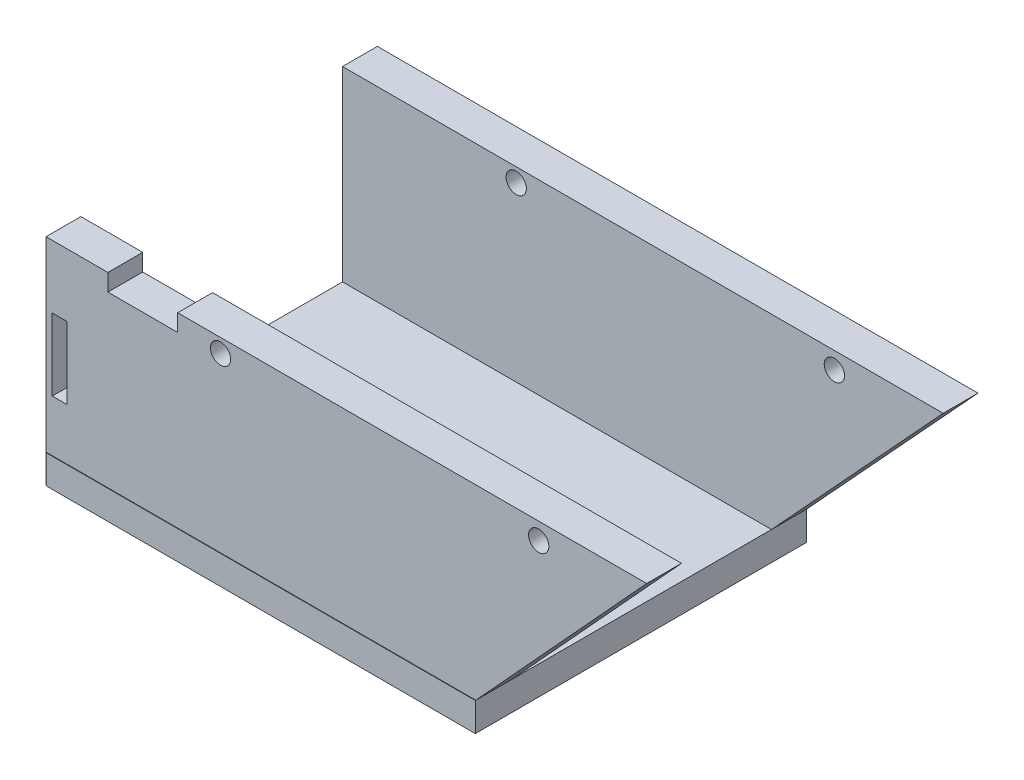
from build123d import *

# Parameters (mm, degrees)
SKETCH1_W           = 83.722982013
SKETCH1_H           = 46.138643349
BOSS_EXTRUDE1_DEPTH = 4
SKETCH2_W           = 83.722982013
SKETCH2_H           = 4.859440563
BOSS_EXTRUDE2_DEPTH = 30
CUT_EXTRUDE10_DEPTH = 18
CUT_EXTRUDE11_DEPTH = 18
SKETCH7_W           = 22.745855452
SKETCH7_H           = 4
CUT_EXTRUDE14_DEPTH = 54
SKETCH8_W           = 11.05148618
SKETCH8_H           = 10.398194851
CUT_EXTRUDE15_DEPTH = 2
SKETCH9_W           = 9.731504247
SKETCH9_H           = 2.37712486
CUT_EXTRUDE16_DEPTH = 8
SKETCH10_W          = 2.06895071
SKETCH10_H          = 10.033558555
CUT_EXTRUDE17_DEPTH = 8
SKETCH11_W          = 1.186464173
SKETCH11_H          = 4
CUT_EXTRUDE18_DEPTH = 47
CUT_EXTRUDE19_DEPTH = 47
SKETCH13_R          = 1.414529115
CUT_EXTRUDE20_DEPTH = 58


with BuildPart() as part:
    # Sketch1 → Boss-Extrude1 (new body)
    with BuildSketch(Plane(origin=(0, 0, 0), x_dir=(1, 0, 0), z_dir=(0, 1, 0))):
        with Locations((41.861491007, 23.069321675)):
            Rectangle(SKETCH1_W, SKETCH1_H)
    extrude(amount=BOSS_EXTRUDE1_DEPTH)

    # Sketch2 → Boss-Extrude2 (add)
    with BuildSketch(Plane(origin=(0, 0, 0), x_dir=(1, 0, 0), z_dir=(0, 1, 0))):
        with Locations((41.861491007, 43.708923068)):
            Rectangle(SKETCH2_W, SKETCH2_H)
        with Locations((41.740293795, 2.496094928)):
            Rectangle(SKETCH2_W, SKETCH2_H)
    extrude(amount=BOSS_EXTRUDE2_DEPTH)

    # Sketch3 → Cut-Extrude10 (cut)
    with BuildSketch(Plane.XY.offset(-0.066374646)):
        Polygon((83.601784801, 30), (83.601784801, 4), (60.885327478, 4), align=None)
    extrude(amount=-CUT_EXTRUDE10_DEPTH, mode=Mode.SUBTRACT)

    # Sketch6 → Cut-Extrude11 (cut)
    with BuildSketch(Plane.XY.offset(-41.279202786)):
        Polygon((83.722982013, 30), (59.790662388, 4), (83.722982013, 4), align=None)
    extrude(amount=-CUT_EXTRUDE11_DEPTH, mode=Mode.SUBTRACT)

    # Sketch7 → Cut-Extrude14 (cut)
    with BuildSketch(Plane.XY):
        with Locations((72.350054287, 2)):
            Rectangle(SKETCH7_W, SKETCH7_H)
    extrude(amount=-CUT_EXTRUDE14_DEPTH, mode=Mode.SUBTRACT)

    # Sketch8 → Cut-Extrude15 (cut)
    with BuildSketch(Plane.XZ):
        with Locations((23.113449186, -14.294853075)):
            Rectangle(SKETCH8_W, SKETCH8_H)
    extrude(amount=-CUT_EXTRUDE15_DEPTH, mode=Mode.SUBTRACT)

    # Sketch9 → Cut-Extrude16 (cut)
    with BuildSketch(Plane.XY.offset(-0.066374646)):
        with Locations((13.369827145, 28.81143757)):
            Rectangle(SKETCH9_W, SKETCH9_H)
    extrude(amount=-CUT_EXTRUDE16_DEPTH, mode=Mode.SUBTRACT)

    # Sketch10 → Cut-Extrude17 (cut)
    with BuildSketch(Plane.XY.offset(-0.066374646)):
        with Locations((1.781804149, 16.215704525)):
            Rectangle(SKETCH10_W, SKETCH10_H)
    extrude(amount=-CUT_EXTRUDE17_DEPTH, mode=Mode.SUBTRACT)

    # Sketch11 → Cut-Extrude18 (cut)
    with BuildSketch(Plane(origin=(0, 0, -46.138643349), x_dir=(-1, 0, 0), z_dir=(0, 0, -1))):
        with Locations((-60.383894475, 2)):
            Rectangle(SKETCH11_W, SKETCH11_H)
    extrude(amount=-CUT_EXTRUDE18_DEPTH, mode=Mode.SUBTRACT)

    # Sketch12 → Cut-Extrude19 (cut)
    with BuildSketch(Plane(origin=(0, 0, -4.925815209), x_dir=(-1, 0, 0), z_dir=(0, 0, -1))):
        Polygon((-59.790662388, 4), (-83.478150153, 29.858494623), (-60.885327478, 4), align=None)
    extrude(amount=-CUT_EXTRUDE19_DEPTH, mode=Mode.SUBTRACT)

    # Sketch13 → Cut-Extrude20 (cut)
    with BuildSketch(Plane.XY.offset(-0.066374646)):
        with Locations((68.55855115, 27.64576808)):
            Circle(SKETCH13_R)
        with Locations((24.208487852, 28.064292507)):
            Circle(SKETCH13_R)
    extrude(amount=-CUT_EXTRUDE20_DEPTH, mode=Mode.SUBTRACT)


solid = part.part
